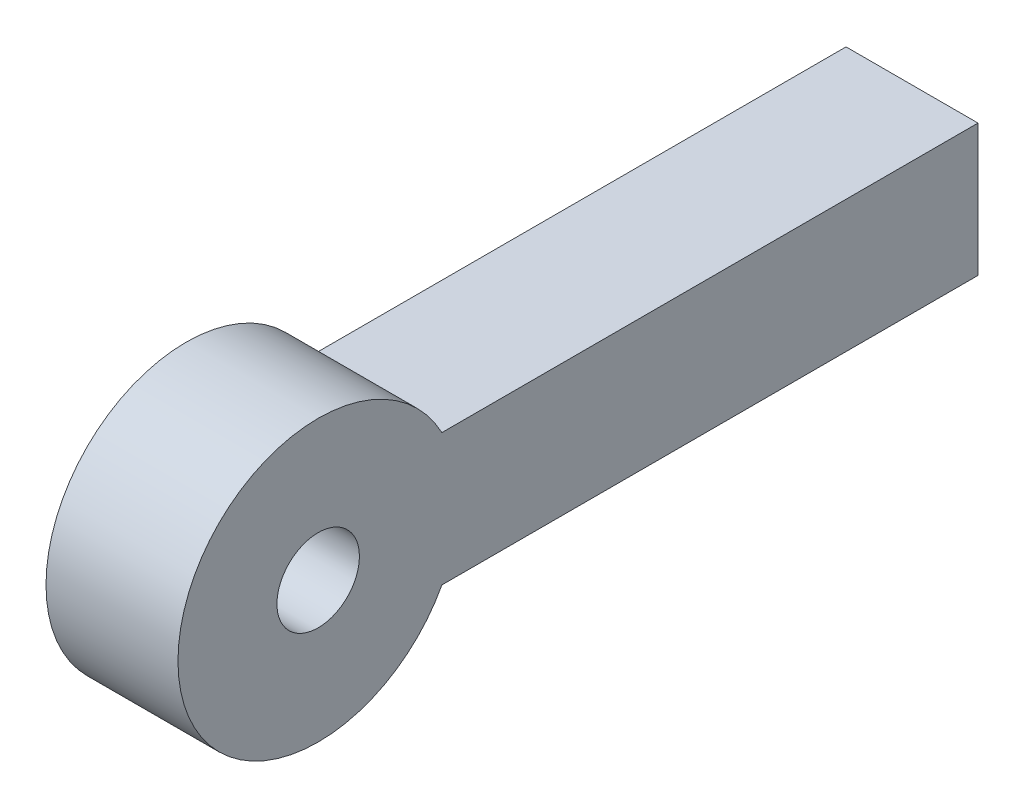
from build123d import *

# Parameters (mm, degrees)
IZIM1_R                     = 0.5
Y_KSEKLIK_EKSTR_ZYON1_DEPTH = 1.6


with BuildPart() as part:
    # Çizim1 → Yükseklik-Ekstrüzyon1 (new body)
    with BuildSketch(Plane(origin=(0, 0, 0), x_dir=(0, 0, -1), z_dir=(1, 0, 0))):
        with BuildLine():
            Line((1.5, -0.8), (8, -0.8))
            Line((8, -0.8), (8, 0.8))
            Line((8, 0.8), (1.5, 0.8))
            ThreePointArc((1.5, 0.8), (-1.7, 0), (1.5, -0.8))
        make_face()
        Circle(IZIM1_R, mode=Mode.SUBTRACT)
    extrude(amount=Y_KSEKLIK_EKSTR_ZYON1_DEPTH)


solid = part.part
